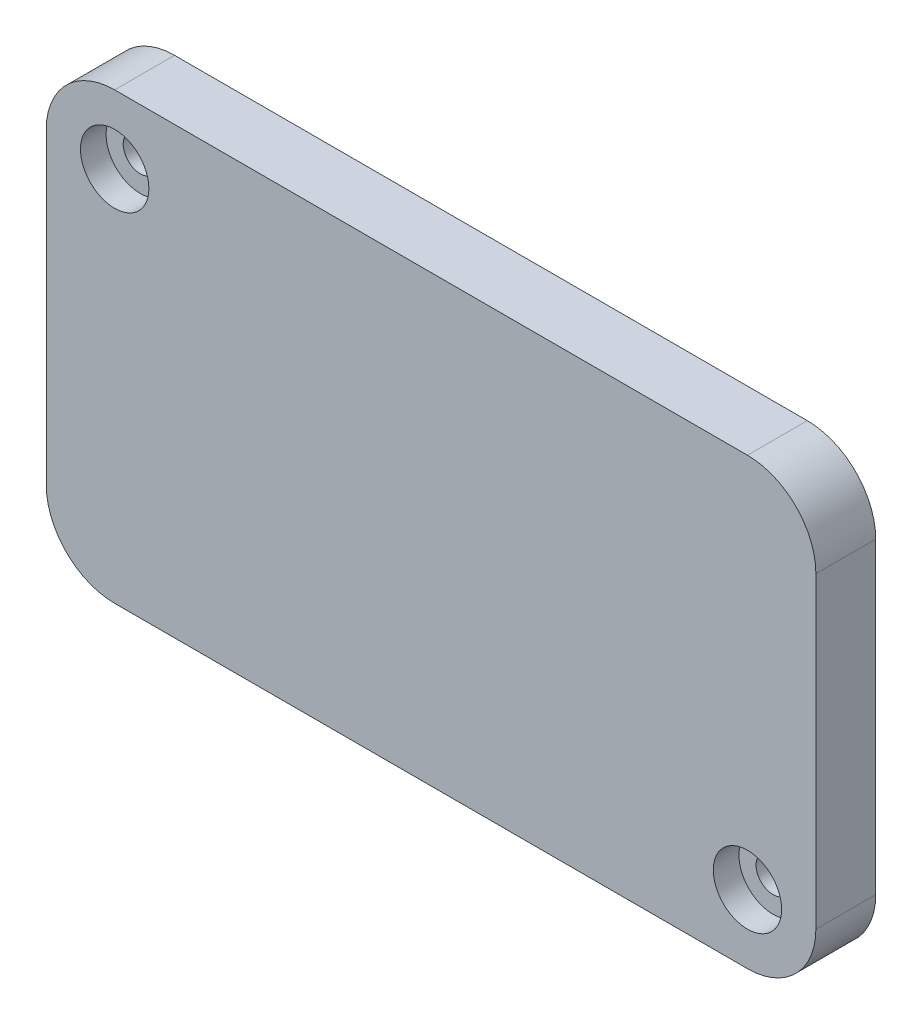
from build123d import *

# Parameters (mm, degrees)
SKETCH1_W           = 45
SKETCH1_H           = 26
SKETCH1_R           = 1
BOSS_EXTRUDE1_DEPTH = 3.5
FILLET1_R           = 4
SKETCH2_R           = 2
CUT_EXTRUDE1_DEPTH  = 1.5


with BuildPart() as part:
    # Sketch1 → Boss-Extrude1 (new body)
    with BuildSketch(Plane.XY):
        with Locations((18.5, -9)):
            Rectangle(SKETCH1_W, SKETCH1_H)
        Circle(SKETCH1_R, mode=Mode.SUBTRACT)
        with Locations((37, -18)):
            Circle(SKETCH1_R, mode=Mode.SUBTRACT)
    extrude(amount=BOSS_EXTRUDE1_DEPTH)

    # Fillet1
    fillet1_edges = [part.edges().sort_by_distance(p)[0] for p in [
        (-4, 4, 1.75),
        (41, 4, 1.75),
        (41, -22, 1.75),
        (-4, -22, 1.75),
    ]]
    fillet(fillet1_edges, radius=FILLET1_R)

    # Sketch2 → Cut-Extrude1 (cut)
    with BuildSketch(Plane.XY.offset(3.5)):
        with Locations((37, -18)):
            Circle(SKETCH2_R)
        Circle(SKETCH2_R)
    extrude(amount=-CUT_EXTRUDE1_DEPTH, mode=Mode.SUBTRACT)


solid = part.part
